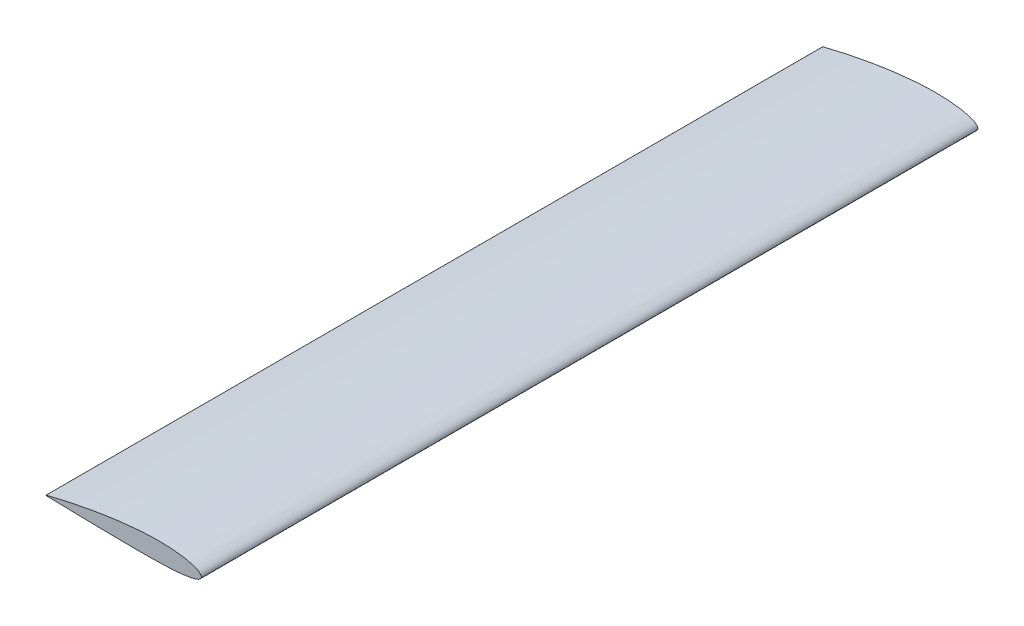
from build123d import *

# Parameters (mm, degrees)
BOSS_EXTRUDE1_DEPTH = 200


with BuildPart() as part:
    # Sketch2 → Boss-Extrude1 (new body)
    with BuildSketch(Plane(origin=(17.440169359, 0, 0), x_dir=(1, 0, 0), z_dir=(0, 0, 1))):
        with BuildLine():
            ThreePointArc((-38.955157451, 1.492895053), (-38.995095838, 1.439101765), (-38.950621034, 1.388994037))
            add(Edge.make_bspline(
                [(-38.955157451, 1.492895053), (-38.295450211, 1.65836191), (-36.977768402, 1.98886104), (-34.338118745, 2.604088974), (-31.033670068, 3.302340733), (-27.061704407, 4.049112578), (-23.086249568, 4.700839132), (-19.103482356, 5.224842347), (-15.116700579, 5.636003553), (-11.783536351, 5.82166567), (-9.11341676, 5.827694698), (-7.105746611, 5.753362438), (-5.091431246, 5.584789176), (-3.410557806, 5.342292948), (-2.065932961, 5.043623126), (-1.04416569, 4.763325516), (-0.173974216, 4.42275119), (0.582415767, 3.996804422), (1.259160845, 3.232625665), (0.622534677, 2.507159065), (-0.086213765, 2.158012906), (-0.925619145, 1.879655861), (-1.92235798, 1.662832147), (-3.25028318, 1.456957035), (-4.910940517, 1.270617036), (-6.908929532, 1.137743494), (-8.907757188, 1.056832806), (-11.574700422, 0.999315552), (-14.910101217, 0.959719147), (-18.914584497, 0.969404554), (-22.920319295, 1.034346952), (-26.92714373, 1.108696118), (-30.934784114, 1.186054986), (-34.274352572, 1.272646837), (-36.946538119, 1.3352315), (-38.282562813, 1.371072371), (-38.950621034, 1.388994037)],
                knots=[0, 0, 0, 0, 0.02501249, 0.049959286, 0.099672925, 0.14920632, 0.198581097, 0.24780517, 0.296916575, 0.345952722, 0.370491626, 0.395091204, 0.419814796, 0.444798575, 0.457489819, 0.470406405, 0.483879409, 0.49126412, 0.503458853, 0.513609129, 0.520450991, 0.533235388, 0.545691039, 0.558031884, 0.582609167, 0.607134742, 0.63165208, 0.656174272, 0.705233949, 0.754320379, 0.803437364, 0.852566096, 0.901700994, 0.950848809, 0.975422717, 1, 1, 1, 1], degree=3))
        make_face()
    extrude(amount=BOSS_EXTRUDE1_DEPTH)


solid = part.part
